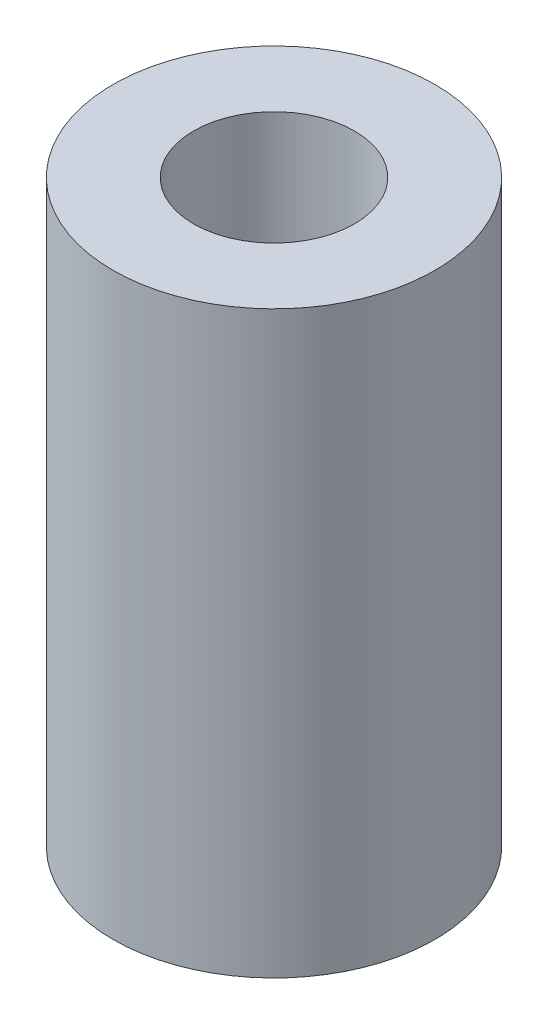
from build123d import *

# Parameters (mm, degrees)
SKETCH_1_R      = 7
SKETCH_1_R_2    = 3.5
EXTRUDE_1_DEPTH = 25.2


with BuildPart() as part:
    # Эскиз1 → Вытянуть1 (new body)
    with BuildSketch(Plane(origin=(0, 0, 0), x_dir=(1, 0, 0), z_dir=(0, 1, 0))):
        with Locations(Location((0, 0, 0), (0, 0, 270))):
            Circle(SKETCH_1_R)
        with Locations(Location((0, 0, 0), (0, 0, 270))):
            Circle(SKETCH_1_R_2, mode=Mode.SUBTRACT)
    extrude(amount=EXTRUDE_1_DEPTH)


solid = part.part
